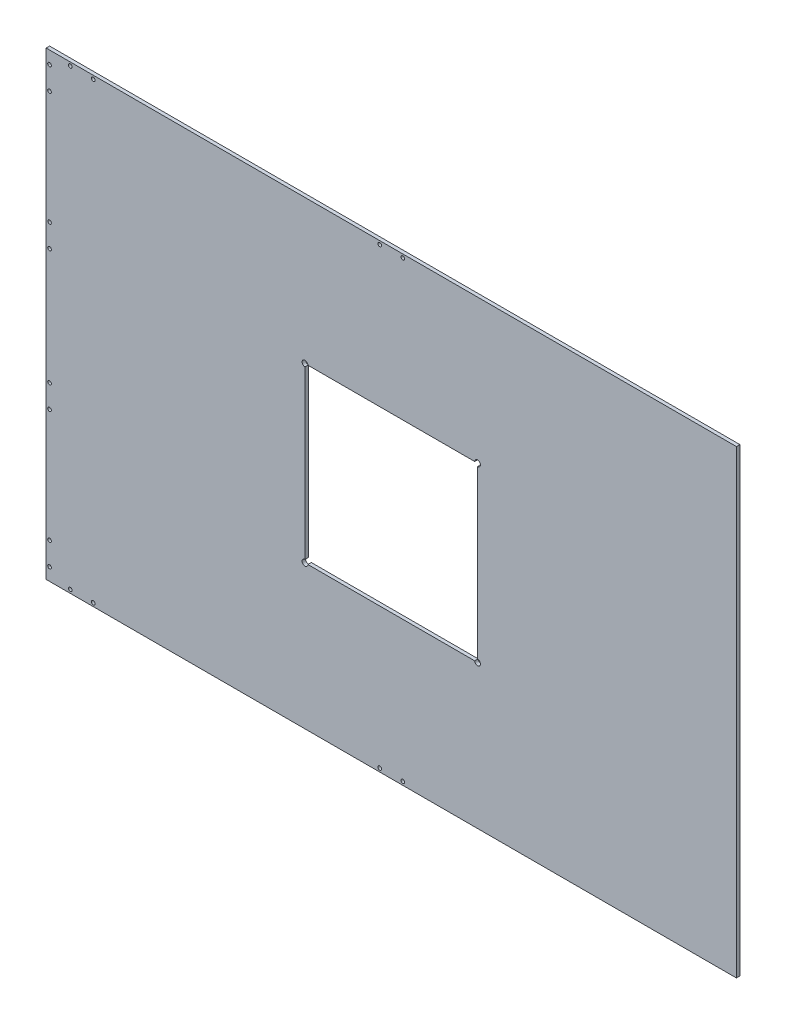
from build123d import *

# Parameters (mm, degrees)
SKETCH_1_W          = 600
SKETCH_1_H          = 400
EXTRUDE_1_DEPTH     = 3
SKETCH_2_R          = 1.6
CUT_EXTRUDE_1_DEPTH = 361.567608085
SKETCH_3_R          = 1.6
CUT_EXTRUDE_2_DEPTH = 361.567608085
SKETCH_4_W          = 150
SKETCH_4_H          = 150
CUT_EXTRUDE_3_DEPTH = 361.567608085
SKETCH_5_R          = 2.5
CUT_EXTRUDE_4_DEPTH = 361.567608085
SKETCH_6_R          = 1.575
CUT_EXTRUDE_5_DEPTH = 361.567608085


with BuildPart() as part:
    # 草图1 → 凸台-拉伸1 (new body)
    with BuildSketch(Plane.XY):
        Rectangle(SKETCH_1_W, SKETCH_1_H)
    extrude(amount=EXTRUDE_1_DEPTH)

    # 草图2 → 切除-拉伸1 (cut, through all)
    with BuildSketch(Plane.XY.offset(3)):
        with Locations((-10, -197)):
            Circle(SKETCH_2_R)
        with Locations((10, -197)):
            Circle(SKETCH_2_R)
        with Locations(Location((10, 197, 0), (0, 0, 180))):
            Circle(SKETCH_2_R)
        with Locations(Location((-10, 197, 0), (0, 0, 180))):
            Circle(SKETCH_2_R)
    extrude(amount=-CUT_EXTRUDE_1_DEPTH, mode=Mode.SUBTRACT)

    # 草图3 → 切除-拉伸2 (cut, through all)
    with BuildSketch(Plane.XY.offset(3)):
        with Locations((-297, 169)):
            Circle(SKETCH_3_R)
        with Locations((-297, 189)):
            Circle(SKETCH_3_R)
        with Locations((-279, 197)):
            Circle(SKETCH_3_R)
        with Locations((-259, 197)):
            Circle(SKETCH_3_R)
        with Locations(Location((-259, -197, 0), (0, 0, 180))):
            Circle(SKETCH_3_R)
        with Locations(Location((-279, -197, 0), (0, 0, 180))):
            Circle(SKETCH_3_R)
        with Locations(Location((-297, -189, 0), (0, 0, 180))):
            Circle(SKETCH_3_R)
        with Locations(Location((-297, -169, 0), (0, 0, 180))):
            Circle(SKETCH_3_R)
    extrude(amount=-CUT_EXTRUDE_2_DEPTH, mode=Mode.SUBTRACT)

    # 草图4 → 切除-拉伸3 (cut, through all)
    with BuildSketch(Plane(origin=(0, 0, 0), x_dir=(-1, 0, 0), z_dir=(0, 0, -1))):
        Rectangle(SKETCH_4_W, SKETCH_4_H)
    extrude(amount=-CUT_EXTRUDE_3_DEPTH, mode=Mode.SUBTRACT)

    # 草图5 → 切除-拉伸4 (cut, through all)
    with BuildSketch(Plane(origin=(0, 0, 0), x_dir=(-1, 0, 0), z_dir=(0, 0, -1))):
        with Locations((75, 75)):
            Circle(SKETCH_5_R)
        with Locations((75, -75)):
            Circle(SKETCH_5_R)
        with Locations((-75, -75)):
            Circle(SKETCH_5_R)
        with Locations((-75, 75)):
            Circle(SKETCH_5_R)
    extrude(amount=-CUT_EXTRUDE_4_DEPTH, mode=Mode.SUBTRACT)

    # 草图6 → 切除-拉伸5 (cut, through all)
    with BuildSketch(Plane(origin=(0, 0, 0), x_dir=(-1, 0, 0), z_dir=(0, 0, -1))):
        with Locations((297, -50.5)):
            Circle(SKETCH_6_R)
        with Locations((297, -70.5)):
            Circle(SKETCH_6_R)
        with Locations(Location((297, 70.5, 0), (0, 0, 180))):
            Circle(SKETCH_6_R)
        with Locations(Location((297, 50.5, 0), (0, 0, 180))):
            Circle(SKETCH_6_R)
    extrude(amount=-CUT_EXTRUDE_5_DEPTH, mode=Mode.SUBTRACT)


solid = part.part
